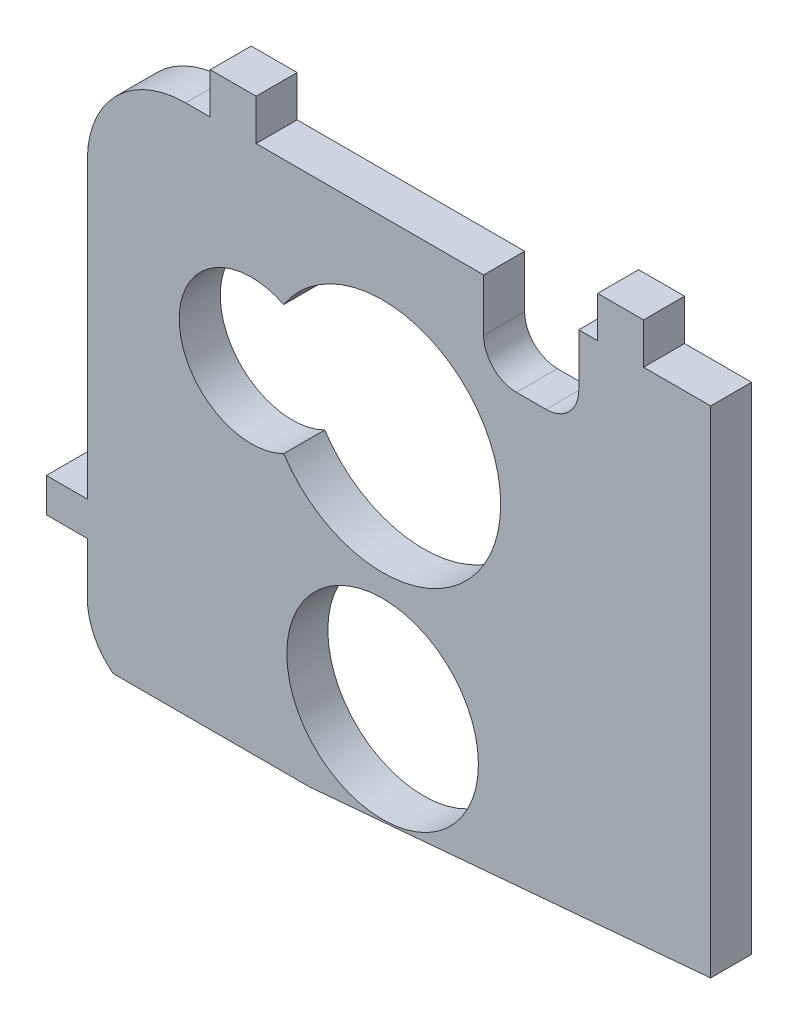
from build123d import *

# Parameters (mm, degrees)
SKETCH1_R           = 3.7084
SKETCH1_W           = 1.778
SKETCH1_H           = 1.5875
SKETCH1_W_2         = 1.5875
SKETCH1_H_2         = 1.3208
BOSS_EXTRUDE1_DEPTH = 1.5875
SKETCH3_W           = 3.683
SKETCH3_H           = 3.302
CUT_EXTRUDE1_DEPTH  = 23.34938408
FILLET1_R           = 1.27


with BuildPart() as part:
    # Sketch1 → Boss-Extrude1 (new body)
    # profile 1 of 4: a face of its own
    with BuildSketch(Plane.XY):
        with BuildLine():
            Line((-10.431265191, -4.028360607), (-2.823309713, -4.028360607))
            Line((-2.823309713, -4.028360607), (12.7, -2.670246987))
            Line((12.7, -2.670246987), (12.7, 16.51))
            Line((12.7, 16.51), (10.10362126, 16.51))
            Line((10.10362126, 16.51), (8.32562126, 16.51))
            Line((8.32562126, 16.51), (-4.89637874, 16.51))
            Line((-4.89637874, 16.51), (-6.67437874, 16.51))
            Line((-6.67437874, 16.51), (-7.62, 16.51))
            ThreePointArc((-7.62, 16.51), (-10.314076836, 15.394076836), (-11.43, 12.7))
            Line((-11.43, 12.7), (-11.43, 1.3208))
            Line((-11.43, 1.3208), (-11.43, 0))
            Line((-11.43, 0), (-11.43, -2.009424845))
            ThreePointArc((-11.43, -2.009424845), (-11.166665718, -3.135654487), (-10.431265191, -4.028360607))
        make_face()
        Circle(SKETCH1_R, mode=Mode.SUBTRACT)
        with BuildLine():
            ThreePointArc((-3.82905, 11.642311449), (4.572, 9.144), (-3.82905, 6.645688551))
            ThreePointArc((-3.82905, 6.645688551), (-7.874, 9.144), (-3.82905, 11.642311449))
        make_face(mode=Mode.SUBTRACT)
    # profile 2 of 4: a face of its own
    with BuildSketch(Plane.XY):
        with Locations((-5.78537874, 17.30375)):
            Rectangle(SKETCH1_W, SKETCH1_H)
    # profile 3 of 4: a face of its own
    with BuildSketch(Plane.XY):
        with Locations((9.21462126, 17.30375)):
            Rectangle(SKETCH1_W, SKETCH1_H)
    # profile 4 of 4: a face of its own
    with BuildSketch(Plane.XY):
        with Locations((-12.22375, 0.6604)):
            Rectangle(SKETCH1_W_2, SKETCH1_H_2)
    extrude(amount=BOSS_EXTRUDE1_DEPTH)

    # Sketch3 → Cut-Extrude1 (cut, through all)
    with BuildSketch(Plane.XY.offset(1.5875)):
        with Locations((5.753177383, 14.859)):
            Rectangle(SKETCH3_W, SKETCH3_H)
    extrude(amount=-CUT_EXTRUDE1_DEPTH, mode=Mode.SUBTRACT)

    # Fillet1
    fillet1_edges = [part.edges().sort_by_distance(p)[0] for p in [
        (7.594677383, 13.208, 0.79375),
        (3.911677383, 13.208, 0.79375),
    ]]
    fillet(fillet1_edges, radius=FILLET1_R)


solid = part.part
